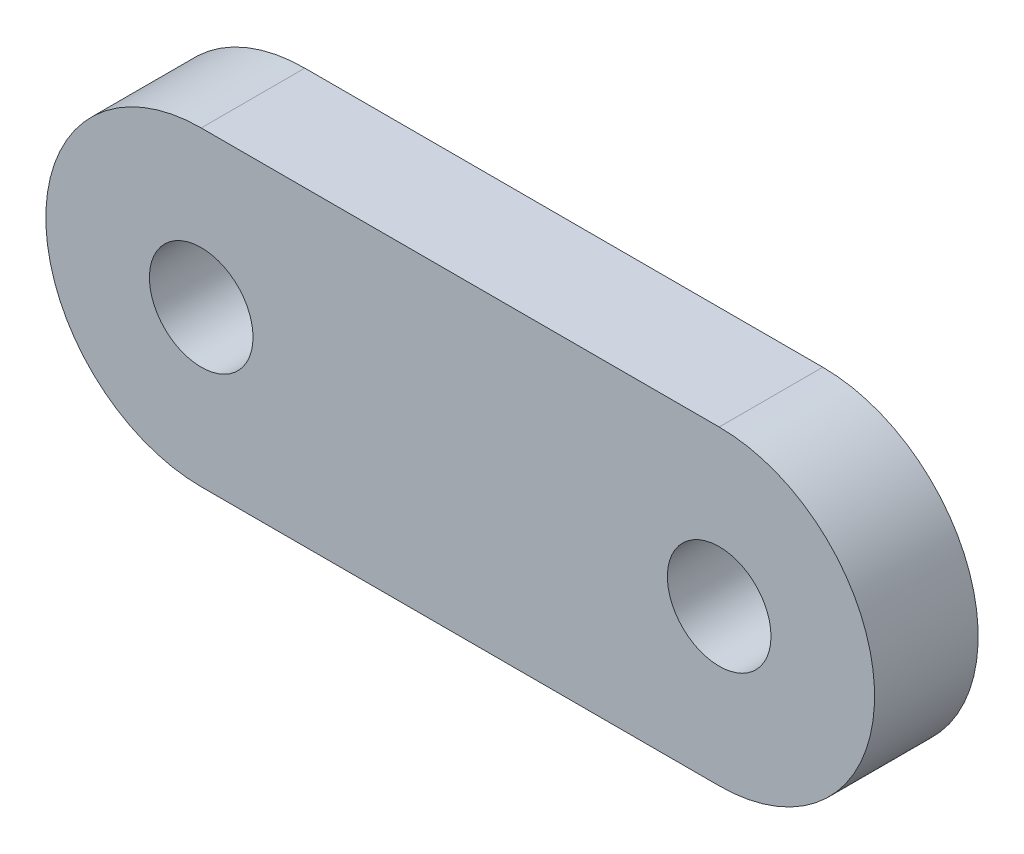
from build123d import *

# Parameters (mm, degrees)
BOSS_EXTRUDE1_DEPTH = 6.35
SKETCH3_R           = 3.175
CUT_EXTRUDE1_DEPTH  = 28.86051193


with BuildPart() as part:
    # Sketch2 → Boss-Extrude1 (new body)
    with BuildSketch(Plane.XY):
        with BuildLine():
            Line((-15.875, 9.525), (15.875, 9.525))
            ThreePointArc((15.875, 9.525), (25.4, 0), (15.875, -9.525))
            Line((15.875, -9.525), (-15.875, -9.525))
            ThreePointArc((-15.875, -9.525), (-25.4, 0), (-15.875, 9.525))
        make_face()
    extrude(amount=BOSS_EXTRUDE1_DEPTH)

    # Sketch3 → Cut-Extrude1 (cut, through all)
    with BuildSketch(Plane.XY.offset(6.35)):
        with Locations((-15.875, 0)):
            Circle(SKETCH3_R)
        with Locations((15.875, 0)):
            Circle(SKETCH3_R)
    extrude(amount=-CUT_EXTRUDE1_DEPTH, mode=Mode.SUBTRACT)


solid = part.part
